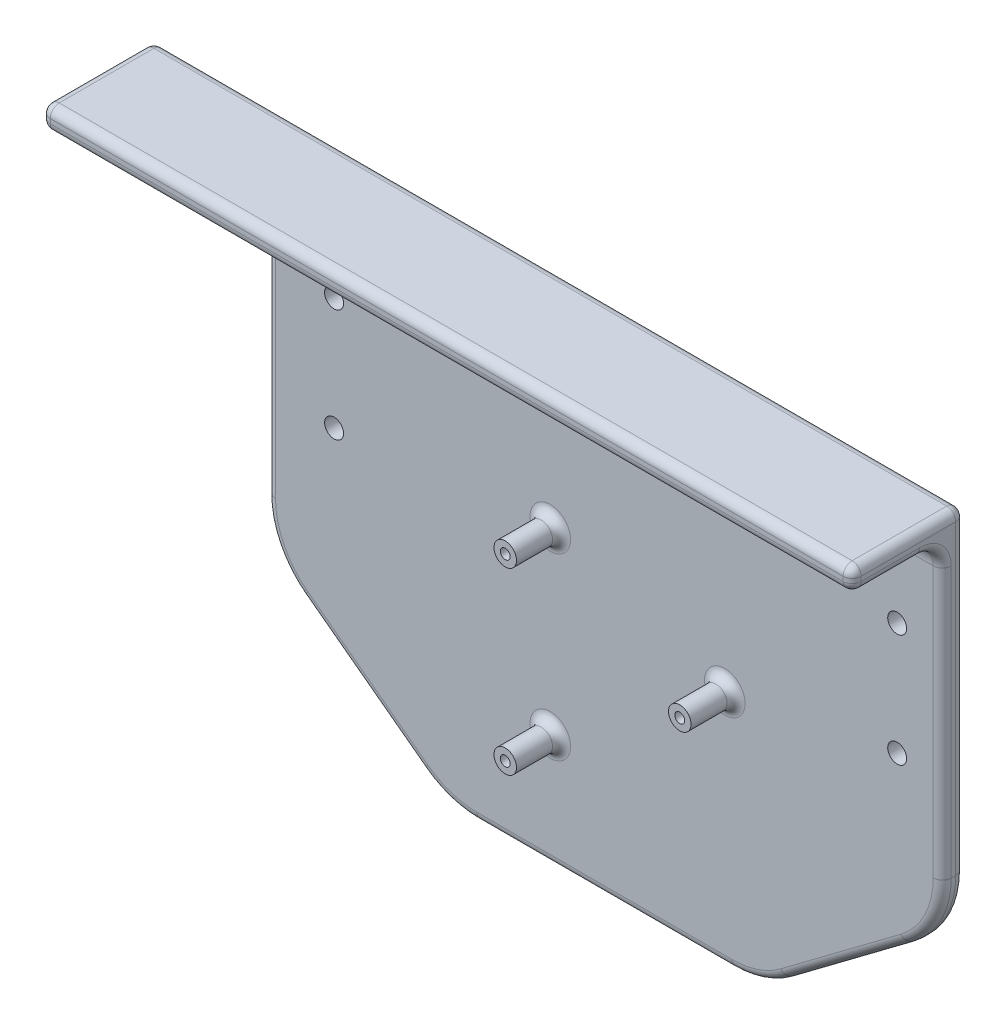
from build123d import *

# Parameters (mm, degrees)
EXTRUDE_1_DEPTH     = 5
SKETCH_2_R          = 2.1
CUT_EXTRUDE_1_DEPTH = 135.629120178
SKETCH_3_W          = 180
SKETCH_3_H          = 5
EXTRUDE_3_DEPTH     = 20
SKETCH_4_R          = 2.5
EXTRUDE_4_DEPTH     = 10
FILLET_1_R          = 5
FILLET_2_R          = 2
SKETCH_5_R          = 1.1
CUT_EXTRUDE_2_DEPTH = 136.369863707
SKETCH_6_R          = 5
CUT_EXTRUDE_3_DEPTH = 2


with BuildPart() as part:
    # ｽｹｯﾁ1 → ﾎﾞｽ - 押し出し1 (new body)
    with BuildSketch(Plane.XY):
        with BuildLine():
            Line((-52, -76), (-25.333333333, -96))
            ThreePointArc((-25.333333333, -96), (-19.657888654, -98.973665961), (-13.333333333, -100))
            Line((-13.333333333, -100), (43.333333333, -100))
            ThreePointArc((43.333333333, -100), (49.657888654, -98.973665961), (55.333333333, -96))
            Line((55.333333333, -96), (82, -76))
            ThreePointArc((82, -76), (87.88854382, -68.94427191), (90, -60))
            Line((90, -60), (90, -10))
            Line((90, -10), (90, 10))
            Line((90, 10), (-90, 10))
            Line((-90, 10), (-90, -10))
            Line((-90, -10), (-60, -10))
            Line((-60, -10), (-60, -60))
            ThreePointArc((-60, -60), (-57.88854382, -68.94427191), (-52, -76))
        make_face()
    extrude(amount=EXTRUDE_1_DEPTH)

    # ｽｹｯﾁ2 → ｶｯﾄ - 押し出し1 (cut, through all)
    with BuildSketch(Plane.XY.offset(5)):
        with Locations((80, -15)):
            Circle(SKETCH_2_R)
        with Locations((-45, -15)):
            Circle(SKETCH_2_R)
        with Locations((80, -40)):
            Circle(SKETCH_2_R)
        with Locations((-45, -40)):
            Circle(SKETCH_2_R)
    extrude(amount=-CUT_EXTRUDE_1_DEPTH, mode=Mode.SUBTRACT)

    # ｽｹｯﾁ3 → ﾎﾞｽ - 押し出し3 (add)
    with BuildSketch(Plane.XY.offset(5)):
        with Locations((0, 7.5)):
            Rectangle(SKETCH_3_W, SKETCH_3_H)
    extrude(amount=EXTRUDE_3_DEPTH)

    # ｽｹｯﾁ4 → ﾎﾞｽ - 押し出し4 (add)
    with BuildSketch(Plane.XY.offset(5)):
        with Locations(Location((3, -35.2, 0), (0, 0, 180))):
            Circle(SKETCH_4_R)
        with Locations(Location((41.741322883, -47.343718593, 0), (0, 0, 180))):
            Circle(SKETCH_4_R)
        with Locations(Location((3, -75, 0), (0, 0, 180))):
            Circle(SKETCH_4_R)
    extrude(amount=EXTRUDE_4_DEPTH)

    # ﾌｨﾚｯﾄ1
    fillet_1_edges = [part.edges().sort_by_distance(p)[0] for p in [
        (0, 5, 5),
    ]]
    fillet(fillet_1_edges, radius=FILLET_1_R)

    # ﾌｨﾚｯﾄ2
    fillet_2_edges = [part.edges().sort_by_distance(p)[0] for p in [
        (87.88854382, -68.94427191, 0),
        (68.666666667, -86, 0),
        (49.657888654, -98.973665961, 0),
        (15, -100, 0),
        (-19.657888654, -98.973665961, 0),
        (-38.666666667, -86, 0),
        (-57.88854382, -68.94427191, 0),
        (-60, -35, 0),
        (-75, -10, 0),
        (-90, 0, 0),
        (0, 10, 0),
        (-75, -10, 5),
        (90, -25, 0),
        (-60, -35, 5),
        (-60, -10, 2.5),
        (-90, 10, 12.5),
        (-57.88854382, -68.94427191, 5),
        (90, 10, 12.5),
        (-38.666666667, -86, 5),
        (-19.657888654, -98.973665961, 5),
        (15, -100, 5),
        (49.657888654, -98.973665961, 5),
        (68.666666667, -86, 5),
        (90, -30, 5),
        (87.88854382, -68.94427191, 5),
        (90, 5, 17.5),
        (-90, 5, 17.5),
        (90, 7.5, 25),
        (0, 10, 25),
        (-90, 7.5, 25),
        (0, 5, 25),
        (5.5, -35.2, 5),
        (44.241322883, -47.343718593, 5),
        (5.5, -75, 5),
        (-90, -5, 5),
        (90, 3.535533906, 6.464466094),
        (-90, 3.535533906, 6.464466094),
    ]]
    fillet(fillet_2_edges, radius=FILLET_2_R)

    # ｽｹｯﾁ5 → ｶｯﾄ - 押し出し2 (cut, through all)
    with BuildSketch(Plane.XY.offset(15)):
        with Locations((3, -35.2)):
            Circle(SKETCH_5_R)
        with Locations((41.741322883, -47.343718593)):
            Circle(SKETCH_5_R)
        with Locations((3, -75)):
            Circle(SKETCH_5_R)
    extrude(amount=-CUT_EXTRUDE_2_DEPTH, mode=Mode.SUBTRACT)

    # ｽｹｯﾁ6 → ｶｯﾄ - 押し出し3 (cut)
    with BuildSketch(Plane(origin=(0, 0, 0), x_dir=(-1, 0, 0), z_dir=(0, 0, -1))):
        with Locations((-3, -35.2)):
            Circle(SKETCH_6_R)
        with Locations((-3, -75)):
            Circle(SKETCH_6_R)
        with Locations((-41.741322883, -47.343718593)):
            Circle(SKETCH_6_R)
    extrude(amount=-CUT_EXTRUDE_3_DEPTH, mode=Mode.SUBTRACT)


solid = part.part
